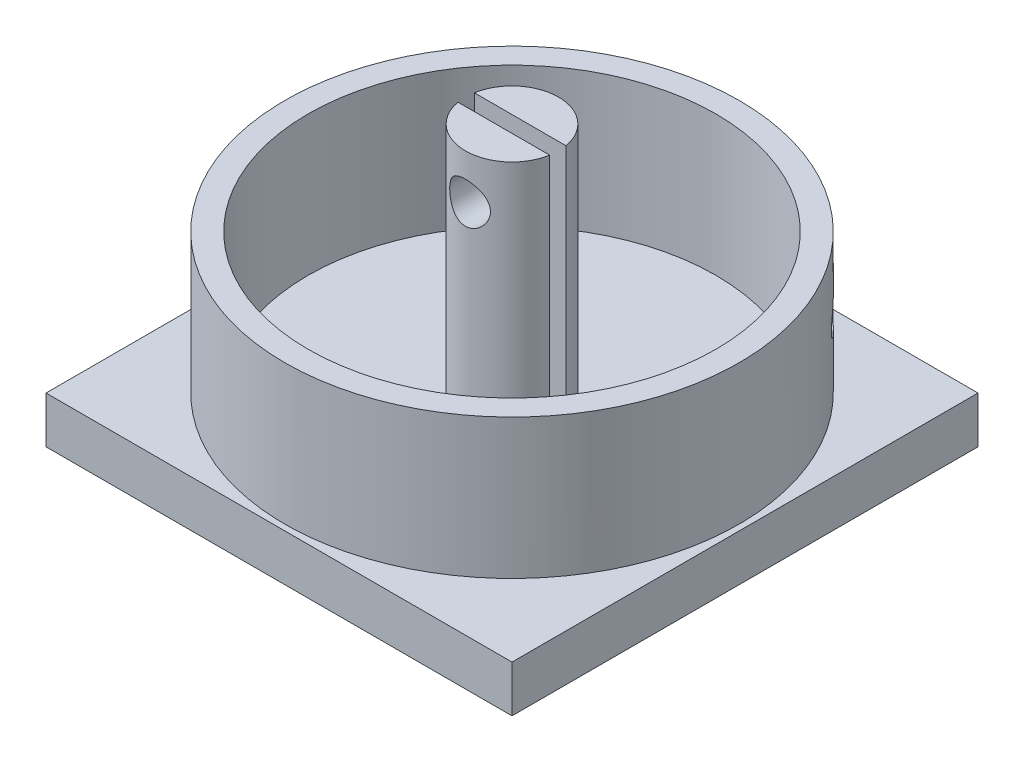
from build123d import *

# Parameters (mm, degrees)
SKETCH1_W           = 20
SKETCH1_H           = 20
BOSS_EXTRUDE1_DEPTH = 2
SKETCH2_R           = 9.75
SKETCH2_R_2         = 8.75
BOSS_EXTRUDE2_DEPTH = 6
BOSS_EXTRUDE3_DEPTH = 9
CUT_EXTRUDE4_DEPTH  = 6
SKETCH6_R           = 0.875
CUT_EXTRUDE5_DEPTH  = 6
BOSS_EXTRUDE4_DEPTH = 1
SKETCH8_R           = 0.6
CUT_EXTRUDE6_DEPTH  = 12


with BuildPart() as part:
    # Sketch1 → Boss-Extrude1 (new body)
    with BuildSketch(Plane(origin=(0, 0, 0), x_dir=(1, 0, 0), z_dir=(0, 1, 0))):
        with Locations((-25.908439561, -86.922355933)):
            Rectangle(SKETCH1_W, SKETCH1_H)
    extrude(amount=BOSS_EXTRUDE1_DEPTH)

    # Sketch2 → Boss-Extrude2 (add)
    with BuildSketch(Plane(origin=(0, 2, 0), x_dir=(1, 0, 0), z_dir=(0, 1, 0))):
        with Locations((-25.908439561, -86.922355933)):
            Circle(SKETCH2_R)
        with Locations((-25.908439561, -86.922355933)):
            Circle(SKETCH2_R_2, mode=Mode.SUBTRACT)
    extrude(amount=BOSS_EXTRUDE2_DEPTH)

    # Sketch3 → Boss-Extrude3 (add)
    with BuildSketch(Plane(origin=(0, 2, 0), x_dir=(1, 0, 0), z_dir=(0, 1, 0))):
        with BuildLine():
            Line((-27.877576428, -86.572355933), (-23.939302694, -86.572355933))
            ThreePointArc((-23.939302694, -86.572355933), (-25.908439561, -84.922355933), (-27.877576428, -86.572355933))
        make_face()
        with BuildLine():
            Line((-23.939302694, -87.272355933), (-27.877576428, -87.272355933))
            ThreePointArc((-27.877576428, -87.272355933), (-25.908439561, -88.922355933), (-23.939302694, -87.272355933))
        make_face()
    extrude(amount=BOSS_EXTRUDE3_DEPTH)

    # Sketch4 → Cut-Extrude4 (cut)
    with BuildSketch(Plane.XY.offset(86.572355933)):
        Polygon((-26.783439561, 9.2), (-25.908439561, 9.2), (-25.033439561, 9.2), (-25.033439561, 10.95), (-26.783439561, 10.95), align=None)
    extrude(amount=-CUT_EXTRUDE4_DEPTH, mode=Mode.SUBTRACT)

    # Sketch6 → Cut-Extrude5 (cut)
    with BuildSketch(Plane(origin=(0, 0, 87.272355933), x_dir=(-1, 0, 0), z_dir=(0, 0, -1))):
        with Locations((25.908439561, 10.075)):
            Circle(SKETCH6_R)
    extrude(amount=-CUT_EXTRUDE5_DEPTH, mode=Mode.SUBTRACT)

    # Sketch7 → Boss-Extrude4 (add)
    with BuildSketch(Plane(origin=(0, 11, 0), x_dir=(1, 0, 0), z_dir=(0, 1, 0))):
        with BuildLine():
            Line((-27.877576428, -86.572355933), (-23.939302694, -86.572355933))
            ThreePointArc((-23.939302694, -86.572355933), (-25.908439561, -84.922355933), (-27.877576428, -86.572355933))
        make_face()
        with BuildLine():
            Line((-23.939302694, -87.272355933), (-27.877576428, -87.272355933))
            ThreePointArc((-27.877576428, -87.272355933), (-25.908439561, -88.922355933), (-23.939302694, -87.272355933))
        make_face()
    extrude(amount=BOSS_EXTRUDE4_DEPTH)

    # Sketch8 → Cut-Extrude6 (cut)
    with BuildSketch(Plane(origin=(0, 0, 76.922355933), x_dir=(-1, 0, 0), z_dir=(0, 0, -1))):
        with Locations((18.908439561, 5)):
            Circle(SKETCH8_R)
    extrude(amount=-CUT_EXTRUDE6_DEPTH, mode=Mode.SUBTRACT)


solid = part.part
